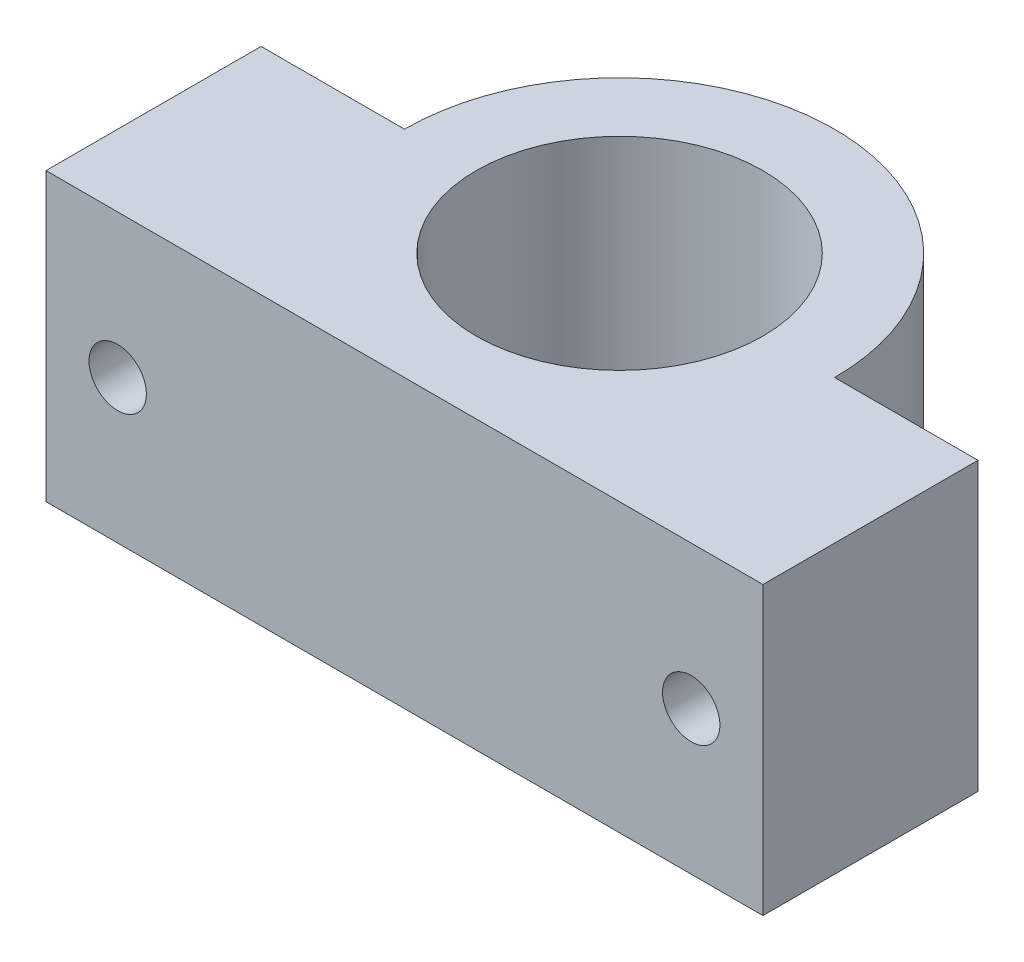
from build123d import *

# Parameters (mm, degrees)
BOSS_EXTRUDE1_DEPTH = 20
SKETCH3_R           = 10
CUT_EXTRUDE1_DEPTH  = 62.64414003
SKETCH4_R           = 2
CUT_EXTRUDE2_DEPTH  = 56.901699437


with BuildPart() as part:
    # Sketch2 → Boss-Extrude1 (new body)
    with BuildSketch(Plane(origin=(0, 0, 0), x_dir=(1, 0, 0), z_dir=(0, 1, 0))):
        with BuildLine():
            Line((-50, 0), (0, 0))
            Line((0, 0), (0, 15))
            Line((0, 15), (-10, 15))
            ThreePointArc((-10, 15), (-25, 30), (-40, 15))
            Line((-40, 15), (-50, 15))
            Line((-50, 15), (-50, 0))
        make_face()
    extrude(amount=BOSS_EXTRUDE1_DEPTH)

    # Sketch3 → Cut-Extrude1 (cut, through all)
    with BuildSketch(Plane(origin=(0, 0, 0), x_dir=(-1, 0, 0), z_dir=(0, -1, 0))):
        with Locations(Location((25, 15, 0), (0, 0, 90))):
            Circle(SKETCH3_R)
    extrude(amount=-CUT_EXTRUDE1_DEPTH, mode=Mode.SUBTRACT)

    # Sketch4 → Cut-Extrude2 (cut, through all)
    with BuildSketch(Plane(origin=(0, 0, -15), x_dir=(-1, 0, 0), z_dir=(0, 0, -1))):
        with Locations((45, 10)):
            Circle(SKETCH4_R)
        with Locations((5, 10)):
            Circle(SKETCH4_R)
    extrude(amount=-CUT_EXTRUDE2_DEPTH, mode=Mode.SUBTRACT)


solid = part.part
